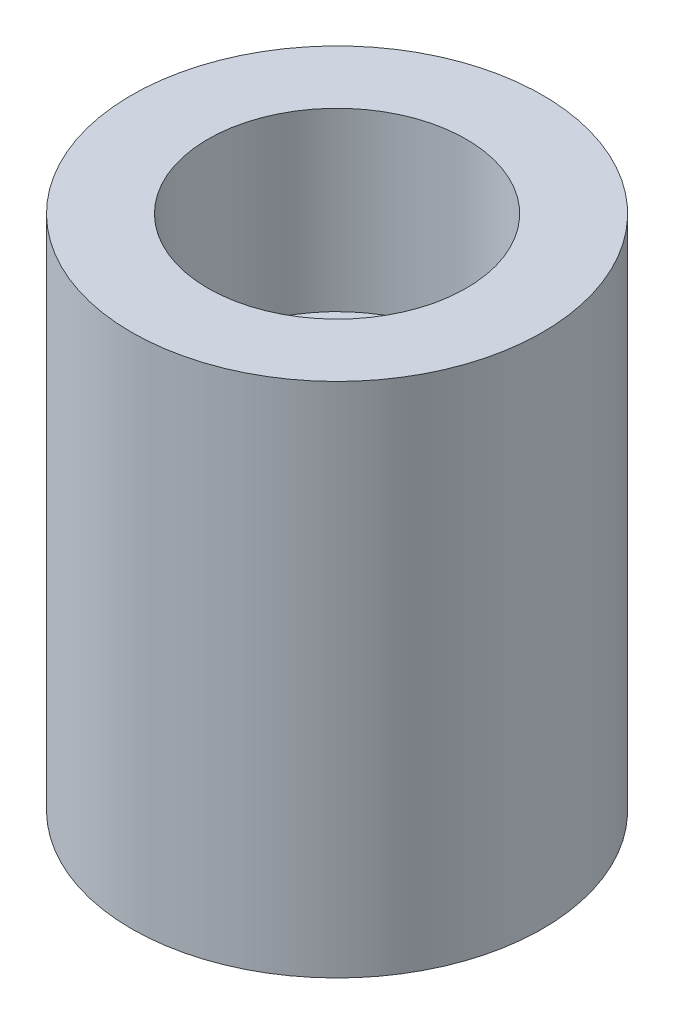
from build123d import *

# Parameters (mm, degrees)
SKETCH_1_R      = 1.75
EXTRUDE_1_DEPTH = 2.9
SKETCH_2_R      = 1.75
SKETCH_2_R_2    = 1.1
EXTRUDE_2_DEPTH = 1.5


with BuildPart() as part:
    # 草图1 → 凸台-拉伸1 (new body)
    with BuildSketch(Plane(origin=(0, 0, 0), x_dir=(1, 0, 0), z_dir=(0, 1, 0))):
        with Locations(Location((0, 0, 0), (0, 0, 270))):
            Circle(SKETCH_1_R)
    extrude(amount=EXTRUDE_1_DEPTH)

    # 草图2 → 凸台-拉伸2 (add)
    with BuildSketch(Plane(origin=(0, 2.9, 0), x_dir=(1, 0, 0), z_dir=(0, 1, 0))):
        with Locations(Location((0, 0, 0), (0, 0, 270))):
            Circle(SKETCH_2_R)
        with Locations(Location((0, 0, 0), (0, 0, 270))):
            Circle(SKETCH_2_R_2, mode=Mode.SUBTRACT)
    extrude(amount=EXTRUDE_2_DEPTH)


solid = part.part
